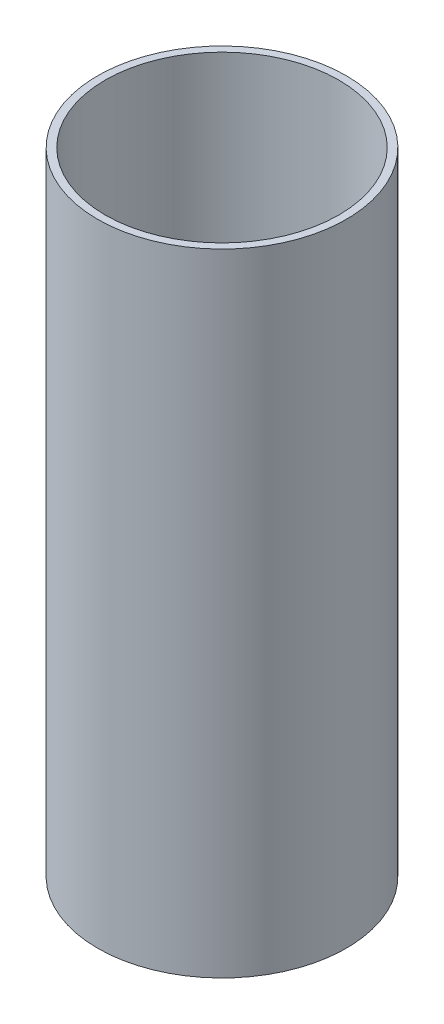
from build123d import *

# Parameters (mm, degrees)
SKETCH1_R           = 33.1
BOSS_EXTRUDE1_DEPTH = 168
SHELL1_T            = 2
CUT_EXTRUDE1_START  = -38
SKETCH2_R           = 31.1
CUT_EXTRUDE1_DEPTH  = 38


with BuildPart() as part:
    # Sketch1 → Boss-Extrude1 (new body)
    with BuildSketch(Plane(origin=(0, 0, 0), x_dir=(1, 0, 0), z_dir=(0, 1, 0))):
        with Locations(Location((0, 0, 0), (0, 0, 90))):
            Circle(SKETCH1_R)
    extrude(amount=BOSS_EXTRUDE1_DEPTH)

    # Shell1 (no face opened: a closed hollow body)
    add(offset(amount=-SHELL1_T, mode=Mode.PRIVATE), mode=Mode.SUBTRACT)

    # Sketch2 → Cut-Extrude1 (cut)
    with BuildSketch(Plane(origin=(0, 168, 0), x_dir=(1, 0, 0), z_dir=(0, 1, 0)).offset(CUT_EXTRUDE1_START)):
        with Locations(Location((0, 0, 0), (0, 0, 90))):
            Circle(SKETCH2_R)
    extrude(amount=CUT_EXTRUDE1_DEPTH, mode=Mode.SUBTRACT)


solid = part.part
